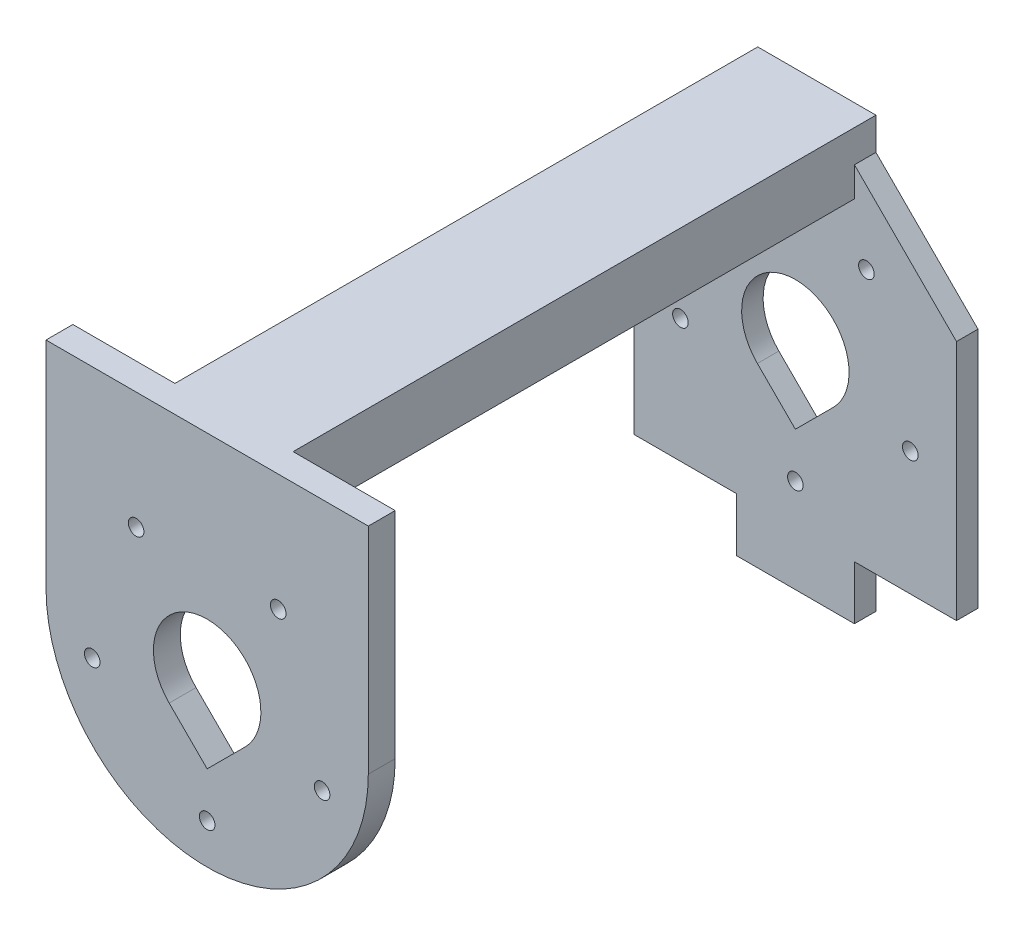
from build123d import *

# Parameters (mm, degrees)
SKETCH1_R           = 30
BOSS_EXTRUDE1_DEPTH = 5
SKETCH2_W           = 60
SKETCH2_H           = 40
BOSS_EXTRUDE2_DEPTH = 5
SKETCH3_R           = 1.45
CUT_EXTRUDE1_DEPTH  = 5
SKETCH4_R           = 1.45
BOSS_EXTRUDE3_DEPTH = 4
SKETCH5_W           = 22
SKETCH5_H           = 11.5
BOSS_EXTRUDE4_DEPTH = 108.5


with BuildPart() as part:
    # Sketch1 → Boss-Extrude1 (new body)
    with BuildSketch(Plane.XY.offset(384.5)):
        with Locations((300, 300)):
            Circle(SKETCH1_R)
    extrude(amount=BOSS_EXTRUDE1_DEPTH)

    # Sketch2 → Boss-Extrude2 (add)
    with BuildSketch(Plane.XY.offset(384.5)):
        with Locations((300, 320)):
            Rectangle(SKETCH2_W, SKETCH2_H)
    extrude(amount=BOSS_EXTRUDE2_DEPTH)

    # Sketch3 → Cut-Extrude1 (cut)
    with BuildSketch(Plane.XY.offset(384.5)):
        with Locations((286.774831823, 318.202882373)):
            Circle(SKETCH3_R)
        with Locations((278.601228383, 293.047117627)):
            Circle(SKETCH3_R)
        with Locations((300, 277.5)):
            Circle(SKETCH3_R)
        with Locations((321.398771617, 293.047117627)):
            Circle(SKETCH3_R)
        with Locations((313.225168177, 318.202882373)):
            Circle(SKETCH3_R)
        with BuildLine():
            Line((292.928932188, 292.928932188), (300, 285.857864376))
            Line((300, 285.857864376), (307.071067812, 292.928932188))
            ThreePointArc((307.071067812, 292.928932188), (300, 310), (292.928932188, 292.928932188))
        make_face()
    extrude(amount=CUT_EXTRUDE1_DEPTH, mode=Mode.SUBTRACT)



with BuildPart() as body_2:
    # Sketch4 → Boss-Extrude3 (new body)
    with BuildSketch(Plane.XY.offset(276)):
        Polygon((289, 340), (311, 340), (311, 334), (330, 315), (330, 270), (311, 270), (311, 260), (289, 260), (289, 270), (270, 270), (270, 315), (289, 334), align=None)
        with Locations((286.774831823, 318.202882373)):
            Circle(SKETCH4_R, mode=Mode.SUBTRACT)
        with Locations((278.601228383, 293.047117627)):
            Circle(SKETCH4_R, mode=Mode.SUBTRACT)
        with Locations((300, 277.5)):
            Circle(SKETCH4_R, mode=Mode.SUBTRACT)
        with Locations((321.398771617, 293.047117627)):
            Circle(SKETCH4_R, mode=Mode.SUBTRACT)
        with Locations((313.225168177, 318.202882373)):
            Circle(SKETCH4_R, mode=Mode.SUBTRACT)
        with BuildLine():
            Line((292.928932188, 292.928932188), (300, 285.857864376))
            Line((300, 285.857864376), (307.071067812, 292.928932188))
            ThreePointArc((307.071067812, 292.928932188), (300, 310), (292.928932188, 292.928932188))
        make_face(mode=Mode.SUBTRACT)
    extrude(amount=BOSS_EXTRUDE3_DEPTH)


with BuildPart() as part_1:
    add(part.part)

    add(body_2.part)  # Boss-Extrude4 merges body 2
    # Sketch5 → Boss-Extrude4 (add)
    with BuildSketch(Plane.XY.offset(276)):
        with Locations((300, 334.25)):
            Rectangle(SKETCH5_W, SKETCH5_H)
    extrude(amount=BOSS_EXTRUDE4_DEPTH)


solid = part_1.part
